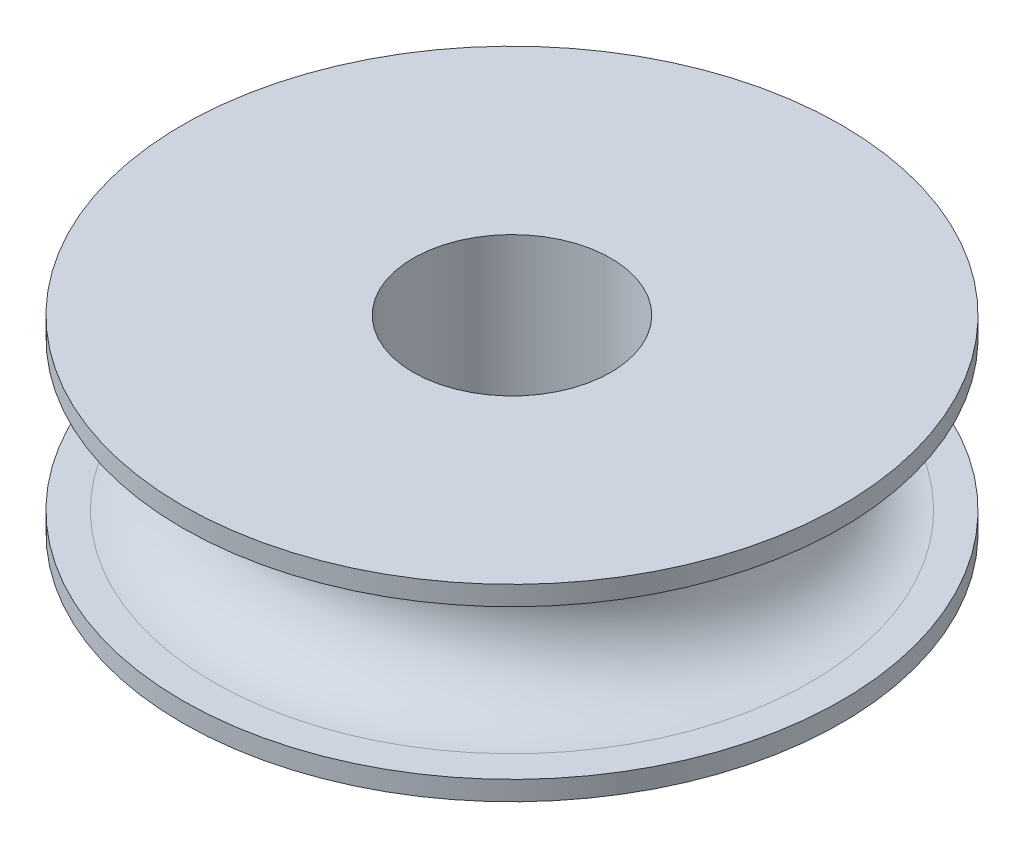
from build123d import *

# Parameters (mm, degrees)
SKETCH2_R                  = 3.15
CUT_EXTRUDE1_DEPTH         = 18.109938632
M2X0_4_TAPPED_HOLE2_REACH  = 21.513
M2X0_4_TAPPED_HOLE2_BORE_R = 0.8


with BuildPart() as part:
    # Sketch1 → Revolve1 (revolve)
    with BuildSketch(Plane.XY, mode=Mode.PRIVATE) as revolve1_sk:
        with BuildLine():
            Line((-10.5, -3), (-5, -3))
            Line((-5, -3), (-5, -5.5))
            Line((-5, -5.5), (0, -5.5))
            Line((0, -5.5), (0, 3))
            Line((0, 3), (-10.5, 3))
            Line((-10.5, 3), (-10.5, 2.38125))
            Line((-10.5, 2.38125), (-9.5, 2.38125))
            ThreePointArc((-9.5, 2.38125), (-7.11875, 0), (-9.5, -2.38125))
            Line((-9.5, -2.38125), (-10.5, -2.38125))
            Line((-10.5, -2.38125), (-10.5, -3))
        make_face()
    revolve(revolve1_sk.sketch.rotate(Axis((0, 5.888182105, 0), (0, -1, 0)), 270), axis=Axis((0, 5.888182105, 0), (0, -1, 0)))

    # Sketch2 → Cut-Extrude1 (cut, through all)
    with BuildSketch(Plane(origin=(0, 3, 0), x_dir=(1, 0, 0), z_dir=(0, 1, 0))):
        with Locations(Location((0, 0, 0), (0, 0, 270))):
            Circle(SKETCH2_R)
    extrude(amount=-CUT_EXTRUDE1_DEPTH, mode=Mode.SUBTRACT)

    # M2x0.4 Tapped Hole2 bore → M2x0.4 Tapped Hole2 (cut, up to next)
    with BuildSketch(Plane(origin=(5, 0, 0), x_dir=(0, 0, -1), z_dir=(1, 0, 0)), mode=Mode.PRIVATE) as m2x0_4_tapped_hole2_sk1:
        with Locations((0, -4.25)):
            Circle(M2X0_4_TAPPED_HOLE2_BORE_R)
    m2x0_4_tapped_hole2_tool1 = extrude(m2x0_4_tapped_hole2_sk1.sketch, amount=-M2X0_4_TAPPED_HOLE2_REACH, mode=Mode.PRIVATE) & part.part
    add(m2x0_4_tapped_hole2_tool1.solids().sort_by_distance((5, -4.25, 0))[0], mode=Mode.SUBTRACT)


solid = part.part
